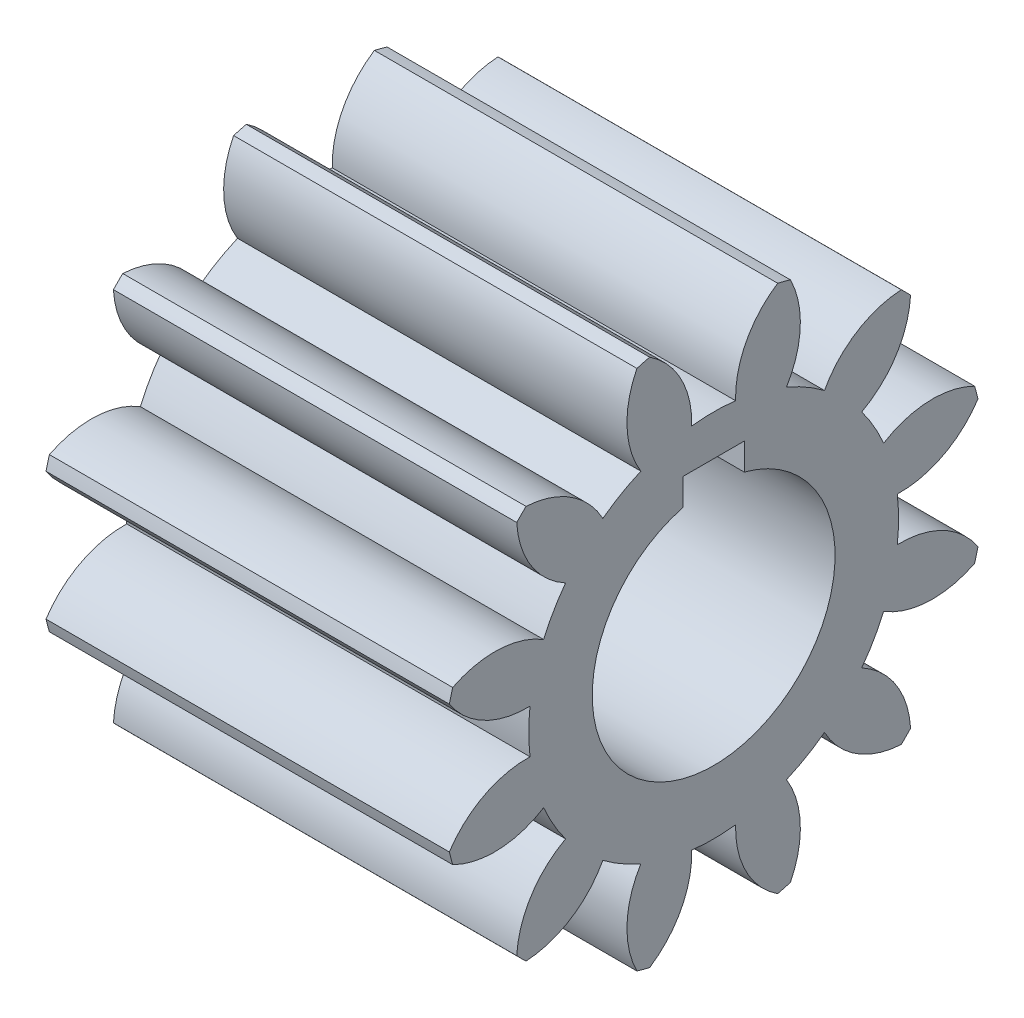
from build123d import *

# Parameters (mm, degrees)
BASPROSKE_W        = 13.1826
BASPROSKE_H        = 8.89
TOOTHCUT_DEPTH     = 19.216617215
TEETHCUTS_COUNT    = 12
TEETHCUTS_ANGLE    = 330
BORSKE_R           = 3.96875
BORE_DEPTH         = 13.1826508
CUT_EXTRUDE1_DEPTH = 18.974701376


with BuildPart() as part:
    # BasProSke → Base-Revolve (revolve)
    with BuildSketch(Plane(origin=(0, 0, 0), x_dir=(1, 0, 0), z_dir=(0, 1, 0)), mode=Mode.PRIVATE) as base_revolve_sk:
        with Locations((6.5913, 4.445)):
            Rectangle(BASPROSKE_W, BASPROSKE_H)
    revolve(base_revolve_sk.sketch.rotate(Axis((-10, 0, 0), (1, 0, 0)), 180), axis=Axis((-10, 0, 0), (1, 0, 0)))

    # TooCutSke → ToothCut (cut, through all)
    with BuildSketch(Plane(origin=(0, 0, 0), x_dir=(0, 0, -1), z_dir=(1, 0, 0))):
        with BuildLine():
            ThreePointArc((0.717076553, 6.002519826), (0, 6.0452), (-0.717076553, 6.002519826))
            ThreePointArc((-0.717076553, 6.002519826), (-1.069160545, 7.516029346), (-2.121611652, 8.659279483))
            ThreePointArc((-2.121611652, 8.659279483), (0, 8.9154), (2.121611652, 8.659279483))
            ThreePointArc((2.121611652, 8.659279483), (1.069160545, 7.516029346), (0.717076553, 6.002519826))
        make_face()
    toothcut = extrude(amount=TOOTHCUT_DEPTH, mode=Mode.SUBTRACT)

    # TeethCuts: ToothCut ×12 about axis
    teethcuts_axis = Axis((-10, 0, 0), (1, 0, 0))
    for i in range(1, TEETHCUTS_COUNT):
        add(toothcut.rotate(teethcuts_axis, i * TEETHCUTS_ANGLE / (TEETHCUTS_COUNT - 1)), mode=Mode.SUBTRACT)

    # BorSke → Bore (cut, symmetric)
    with BuildSketch(Plane(origin=(0, 0, 0), x_dir=(0, 0, -1), z_dir=(1, 0, 0))):
        with Locations(Location((0, 0, 0), (0, 0, 180))):
            Circle(BORSKE_R)
    extrude(amount=BORE_DEPTH, both=True, mode=Mode.SUBTRACT)

    # Sketch1 → Cut-Extrude1 (cut, through all)
    with BuildSketch(Plane(origin=(13.1826, 0, 0), x_dir=(0, 0, -1), z_dir=(1, 0, 0))):
        with BuildLine():
            Line((-1, 3.840700009), (-1, 4.71875))
            Line((-1, 4.71875), (1, 4.71875))
            Line((1, 4.71875), (1, 3.840700009))
            ThreePointArc((1, 3.840700009), (0, 3.96875), (-1, 3.840700009))
        make_face()
    extrude(amount=-CUT_EXTRUDE1_DEPTH, mode=Mode.SUBTRACT)


solid = part.part
